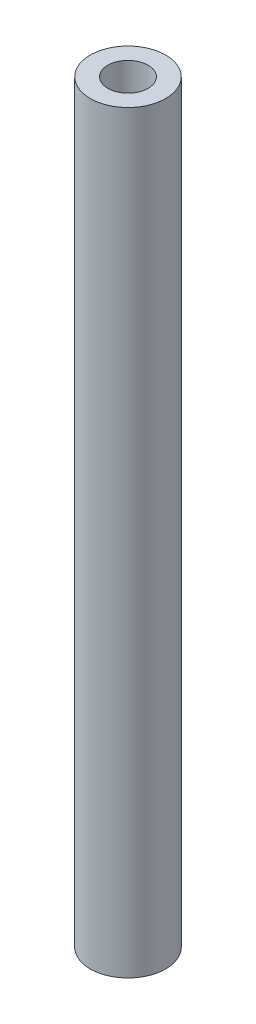
from build123d import *

# Parameters (mm, degrees)
SKETCH1_R           = 6.35
BOSS_EXTRUDE2_DEPTH = 127
SKETCH2_R           = 3.38948585
CUT_EXTRUDE1_DEPTH  = 134.62


with BuildPart() as part:
    # Sketch1 → Boss-Extrude2 (new body)
    with BuildSketch(Plane(origin=(0, 0, 0), x_dir=(1, 0, 0), z_dir=(0, 1, 0))):
        with Locations(Location((0, 0, 0), (0, 0, 270))):
            Circle(SKETCH1_R)
    extrude(amount=BOSS_EXTRUDE2_DEPTH)

    # Sketch2 → Cut-Extrude1 (cut)
    with BuildSketch(Plane(origin=(0, 127, 0), x_dir=(1, 0, 0), z_dir=(0, 1, 0))):
        with Locations(Location((0, 0, 0), (0, 0, 270))):
            Circle(SKETCH2_R)
    extrude(amount=-CUT_EXTRUDE1_DEPTH, mode=Mode.SUBTRACT)


solid = part.part
